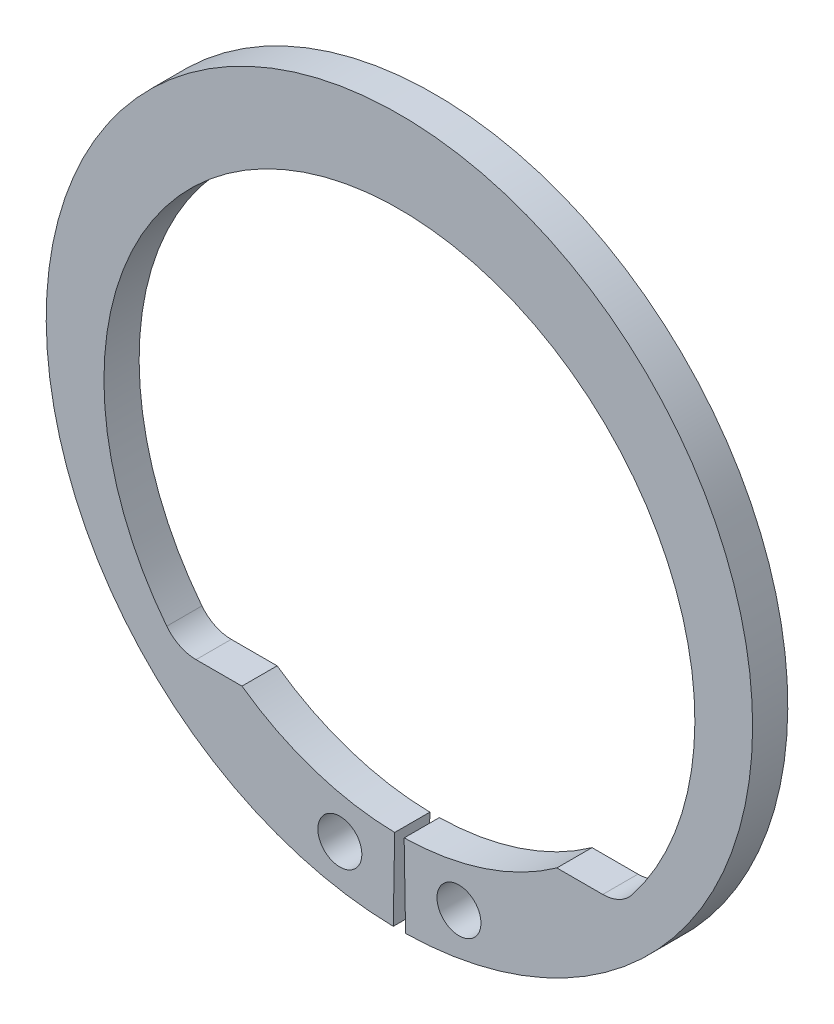
from build123d import *
from build123d.topology import SkipClean

# Parameters (mm, degrees)
SKETCH3_R           = 0.75
BOSS_EXTRUDE1_DEPTH = 0.6
FILLET1_R           = 1.27


with BuildPart() as part:
    # Sketch3 → Boss-Extrude1 (new, symmetric)
    with BuildSketch(Plane.XY):
        with BuildLine():
            Line((-5.37133596, -7.53068722), (-7.53068722, -7.53068722))
            ThreePointArc((-7.53068722, -7.53068722), (-9.196503596, 3.297003953), (0, 9.25))
            Line((0, 9.25), (0, 12.05))
            ThreePointArc((0, 12.05), (-12.049541173, 0.105154753), (-0.210301498, -12.048164727))
            Line((-0.210301498, -12.048164727), (-0.16143476, -9.24859118))
            ThreePointArc((-0.16143476, -9.24859118), (-2.896668166, -8.784748917), (-5.37133596, -7.53068722))
        make_face()
        with Locations((-2.032115801, -10.454329504)):
            Circle(SKETCH3_R, mode=Mode.SUBTRACT)
    extrude(amount=BOSS_EXTRUDE1_DEPTH, both=True)

    # Fillet1
    fillet1_edges = [part.edges().sort_by_distance(p)[0] for p in [
        (-7.53068722, -7.53068722, 0),
    ]]
    fillet(fillet1_edges, radius=FILLET1_R)

    # Mirror1: part across plane


with BuildPart() as part_1:
    with SkipClean():  # the faces are left unmerged after this step: merging them gives an invalid solid
        add(part.part)
        add(part.part.mirror(Plane(origin=(0, 0, 0), x_dir=(0, 0, 1), z_dir=(1, 0, 0))))


solid = part_1.part
